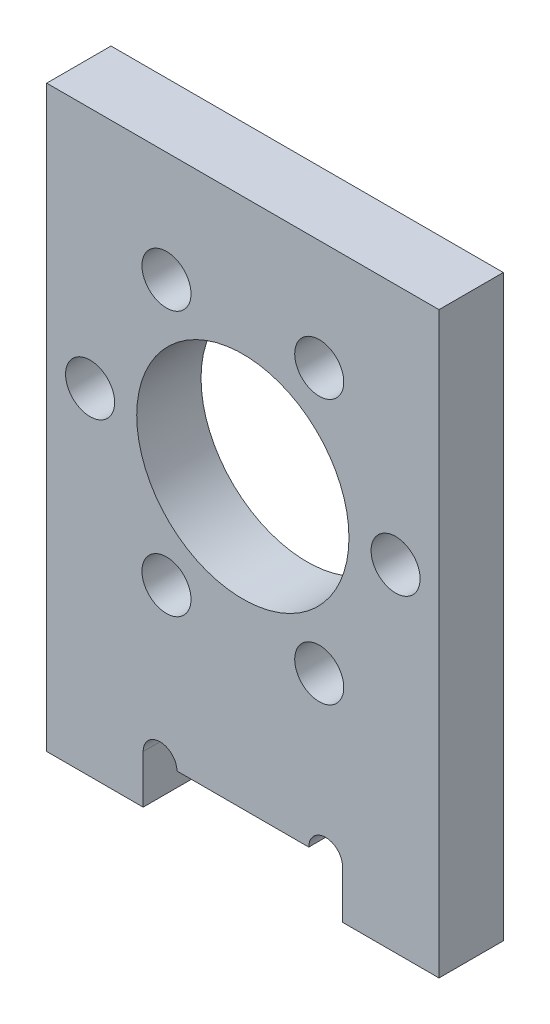
from build123d import *

# Parameters (mm, degrees)
SKETCH_2_W               = 24.4
SKETCH_2_H               = 33
EXTRUDE_1_DEPTH          = 4
SKETCH_3_R               = 6.6
CUT_EXTRUDE_1_DEPTH      = 4
SKETCH_4_W               = 6
SKETCH_4_H               = 3
EXTRUDE_2_DEPTH          = 4
SKETCH_5_R               = 1.05
CUT_EXTRUDE_2_DEPTH      = 4
SKETCH_6_R               = 1.525
CUT_EXTRUDE_3_DEPTH      = 4
PATTERN_CIRCULAR_1_COUNT = 6


with BuildPart() as part:
    # 草图2 → 凸台-拉伸1 (new body)
    with BuildSketch(Plane.XY):
        Rectangle(SKETCH_2_W, SKETCH_2_H)
    extrude(amount=EXTRUDE_1_DEPTH)

    # 草图3 → 切除-拉伸1 (cut)
    with BuildSketch(Plane.XY.offset(4)):
        with Locations((0, 1.410077419)):
            Circle(SKETCH_3_R)
    extrude(amount=-CUT_EXTRUDE_1_DEPTH, mode=Mode.SUBTRACT)

    # 草图4 → 凸台-拉伸2 (add)
    with BuildSketch(Plane.XY.offset(4)):
        with Locations((9.2, -18)):
            Rectangle(SKETCH_4_W, SKETCH_4_H)
    extrude_2 = extrude(amount=-EXTRUDE_2_DEPTH)

    # 镜向1: 凸台-拉伸2 across plane
    add(extrude_2.mirror(Plane(origin=(0, 0, 0), x_dir=(0, 0, 1), z_dir=(1, 0, 0))))

    # 草图5 → 切除-拉伸2 (cut)
    with BuildSketch(Plane(origin=(0, 0, 0), x_dir=(-1, 0, 0), z_dir=(0, 0, -1))):
        with Locations((-5.15, -16.5)):
            Circle(SKETCH_5_R)
        with Locations((5.15, -16.5)):
            Circle(SKETCH_5_R)
    extrude(amount=-CUT_EXTRUDE_2_DEPTH, mode=Mode.SUBTRACT)

    # 草图6 → 切除-拉伸3 (cut)
    with BuildSketch(Plane.XY.offset(4)):
        with Locations((-4.75, -6.817163916)):
            Circle(SKETCH_6_R)
    cut_extrude_3 = extrude(amount=-CUT_EXTRUDE_3_DEPTH, mode=Mode.SUBTRACT)

    # 阵列(圆周)1: 切除-拉伸3 ×6 about axis
    pattern_circular_1_axis = Axis((0, 1.410077419, 0), (0, 0, 1))
    for i in range(1, PATTERN_CIRCULAR_1_COUNT):
        add(cut_extrude_3.rotate(pattern_circular_1_axis, i * 360 / PATTERN_CIRCULAR_1_COUNT), mode=Mode.SUBTRACT)


solid = part.part
